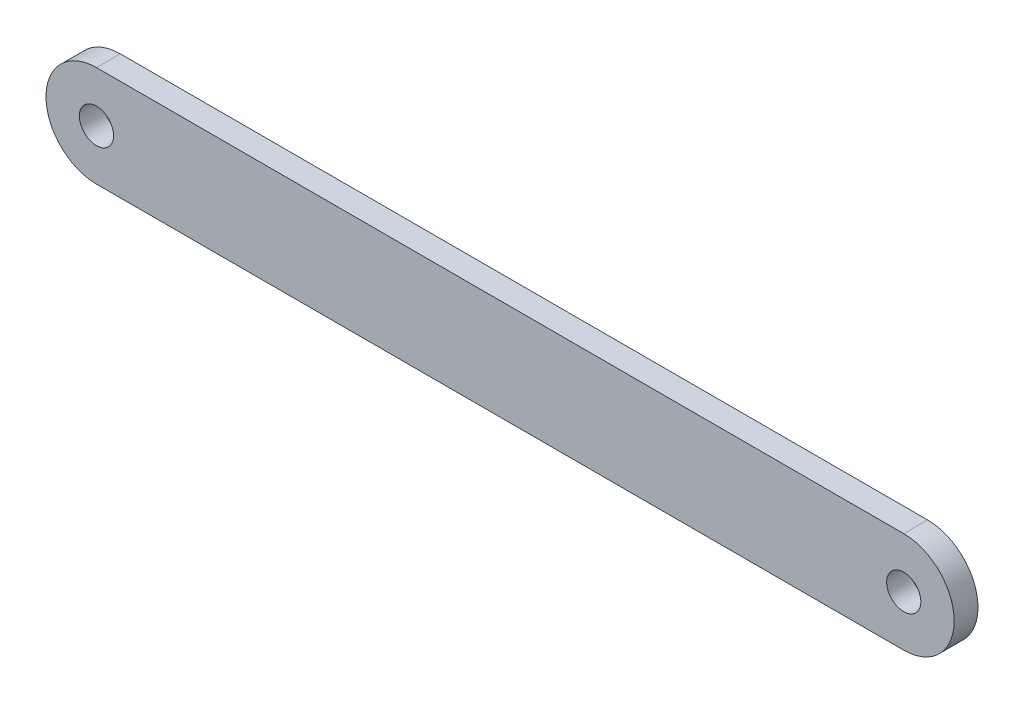
from build123d import *

# Parameters (mm, degrees)
BOSS_EXTRUDE1_DEPTH       = 2.9972
F_8_CLEARANCE_HOLE1_D     = 4.3053
F_8_CLEARANCE_HOLE1_DEPTH = 6.351016


with BuildPart() as part:
    # Sketch1 → Boss-Extrude1 (new body)
    with BuildSketch(Plane.XY):
        with BuildLine():
            Line((-50.8, 6.35), (50.8, 6.35))
            ThreePointArc((50.8, 6.35), (57.15, 0), (50.8, -6.35))
            Line((50.8, -6.35), (-50.8, -6.35))
            ThreePointArc((-50.8, -6.35), (-57.15, 0), (-50.8, 6.35))
        make_face()
    extrude(amount=BOSS_EXTRUDE1_DEPTH)

    # #8 Clearance Hole1
    with Locations(Plane.XY.offset(2.9972)):
        with Locations((-50.8, 0), (50.8, 0)):
            Hole(F_8_CLEARANCE_HOLE1_D / 2, depth=F_8_CLEARANCE_HOLE1_DEPTH)


solid = part.part
